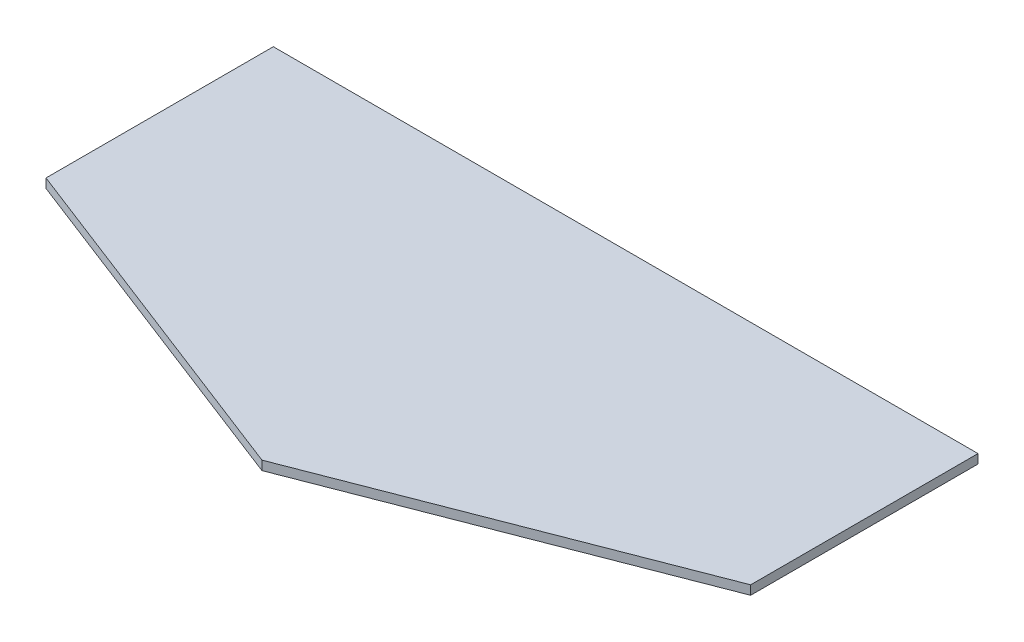
from build123d import *

# Parameters (mm, degrees)
SKETCH1_W           = 310
SKETCH1_H           = 100
BOSS_EXTRUDE1_DEPTH = 4
SCALE1_SCALE        = 0.5


with BuildPart() as part:
    # Sketch1 → Boss-Extrude1 (new body)
    with BuildSketch(Plane(origin=(0, 0, 0), x_dir=(1, 0, 0), z_dir=(0, 1, 0))):
        Polygon((155, -100), (0, -100), (155, -160), align=None)
        with Locations((155, -50)):
            Rectangle(SKETCH1_W, SKETCH1_H)
        Polygon((155, -100), (155, -160), (310, -100), align=None)
    extrude(amount=BOSS_EXTRUDE1_DEPTH)


with BuildPart() as part_1:
    # Scale1: scaled about (155, 2, 66.153846154)
    add(part.part.scale(SCALE1_SCALE).moved(Location((77.5, 1, 33.076923077))))


solid = part_1.part
